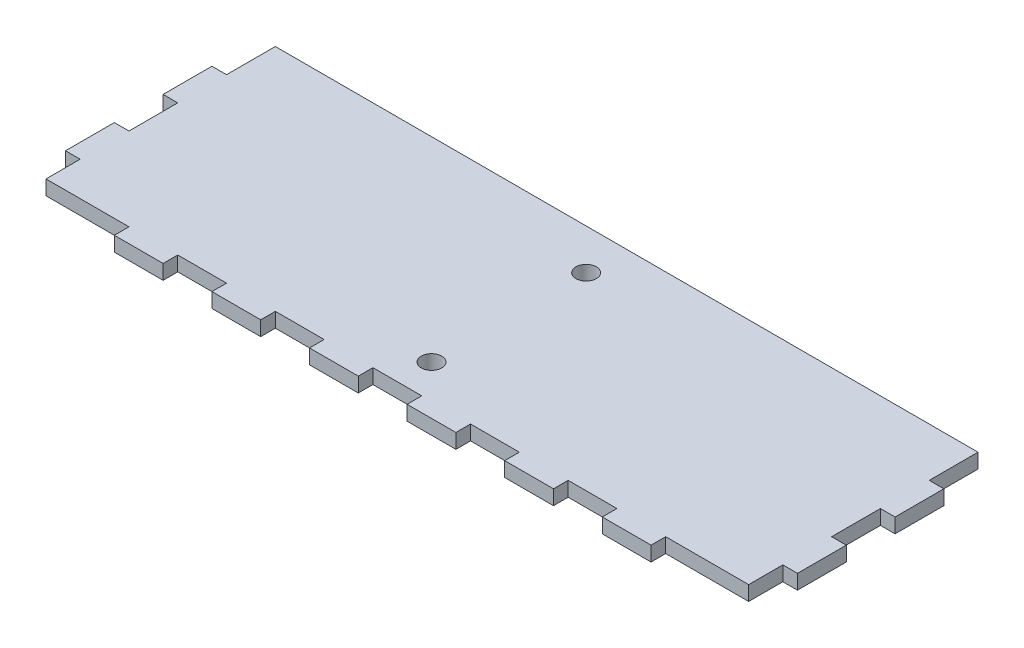
from build123d import *

# Parameters (mm, degrees)
MDFESB_W       = 150
MDFESB_H       = 50
MDF_DEPTH      = 3
ENCAIXEESB_W   = 10
ENCAIXEESB_H   = 3
ENCAIXEESB_W_2 = 3
ENCAIXEESB_H_2 = 10
ENCAIXE_DEPTH  = 3
USESB_R        = 2.1
US_DEPTH       = 3


with BuildPart() as part:
    # mdfEsb → mdf (new body)
    with BuildSketch(Plane(origin=(0, 0, 0), x_dir=(1, 0, 0), z_dir=(0, 1, 0))):
        with Locations((75, 25)):
            Rectangle(MDFESB_W, MDFESB_H)
    extrude(amount=MDF_DEPTH)

    # encaixeEsb → encaixe (cut)
    with BuildSketch(Plane(origin=(0, 3, 0), x_dir=(1, 0, 0), z_dir=(0, 1, 0))):
        Polygon((0, 0), (20, 0), (20, 3), (3, 3), (3, 10), (0, 10), (0, 3), align=None)
        Polygon((150, 0), (130, 0), (130, 3), (147, 3), (147, 10), (150, 10), (150, 3), align=None)
        with Locations((35, 1.5)):
            Rectangle(ENCAIXEESB_W, ENCAIXEESB_H)
        with Locations((55, 1.5)):
            Rectangle(ENCAIXEESB_W, ENCAIXEESB_H)
        with Locations((75, 1.5)):
            Rectangle(ENCAIXEESB_W, ENCAIXEESB_H)
        with Locations((95, 1.5)):
            Rectangle(ENCAIXEESB_W, ENCAIXEESB_H)
        with Locations((115, 1.5)):
            Rectangle(ENCAIXEESB_W, ENCAIXEESB_H)
        with Locations((1.5, 25)):
            Rectangle(ENCAIXEESB_W_2, ENCAIXEESB_H_2)
        with Locations((1.5, 45)):
            Rectangle(ENCAIXEESB_W_2, ENCAIXEESB_H_2)
        with Locations((1.5, 65)):
            Rectangle(ENCAIXEESB_W_2, ENCAIXEESB_H_2)
        with Locations((1.5, 85)):
            Rectangle(ENCAIXEESB_W_2, ENCAIXEESB_H_2)
        with Locations((1.5, 105)):
            Rectangle(ENCAIXEESB_W_2, ENCAIXEESB_H_2)
        with Locations((148.5, 105)):
            Rectangle(ENCAIXEESB_W_2, ENCAIXEESB_H_2)
        with Locations((148.5, 85)):
            Rectangle(ENCAIXEESB_W_2, ENCAIXEESB_H_2)
        with Locations((148.5, 65)):
            Rectangle(ENCAIXEESB_W_2, ENCAIXEESB_H_2)
        with Locations((148.5, 45)):
            Rectangle(ENCAIXEESB_W_2, ENCAIXEESB_H_2)
        with Locations((148.5, 25)):
            Rectangle(ENCAIXEESB_W_2, ENCAIXEESB_H_2)
    extrude(amount=-ENCAIXE_DEPTH, mode=Mode.SUBTRACT)

    # USEsb → US (cut)
    with BuildSketch(Plane(origin=(0, 3, 0), x_dir=(1, 0, 0), z_dir=(0, 1, 0))):
        with Locations(Location((75, 41.7, 0), (0, 0, 270))):
            Circle(USESB_R)
        with Locations(Location((75, 10, 0), (0, 0, 270))):
            Circle(USESB_R)
    extrude(amount=-US_DEPTH, mode=Mode.SUBTRACT)


solid = part.part
